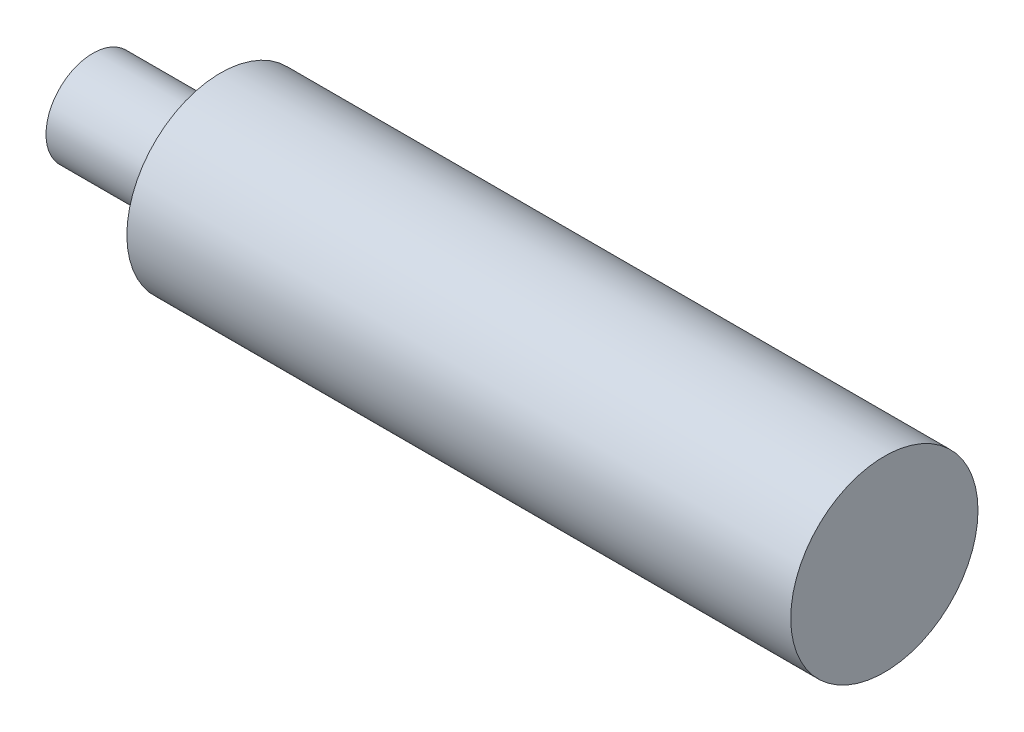
from build123d import *

# Parameters (mm, degrees)
SKETCH1_R           = 55.88
BOSS_EXTRUDE1_DEPTH = 236.22
SKETCH2_OUTSIDE_W   = 213.396
SKETCH2_OUTSIDE_H   = 213.396
SKETCH2_OUTSIDE_R   = 27.94
CUT_EXTRUDE1_DEPTH  = 76.2


with BuildPart() as part:
    # Sketch1 → Boss-Extrude1 (new, symmetric)
    with BuildSketch(Plane(origin=(0, 0, 0), x_dir=(0, 0, -1), z_dir=(1, 0, 0))):
        Circle(SKETCH1_R)
    extrude(amount=BOSS_EXTRUDE1_DEPTH, both=True)

    # Sketch2 outside → Cut-Extrude1 (cut)
    with BuildSketch(Plane.ZY.offset(236.22)):
        Rectangle(SKETCH2_OUTSIDE_W, SKETCH2_OUTSIDE_H)
        Circle(SKETCH2_OUTSIDE_R, mode=Mode.SUBTRACT)
    extrude(amount=-CUT_EXTRUDE1_DEPTH, mode=Mode.SUBTRACT)


solid = part.part
